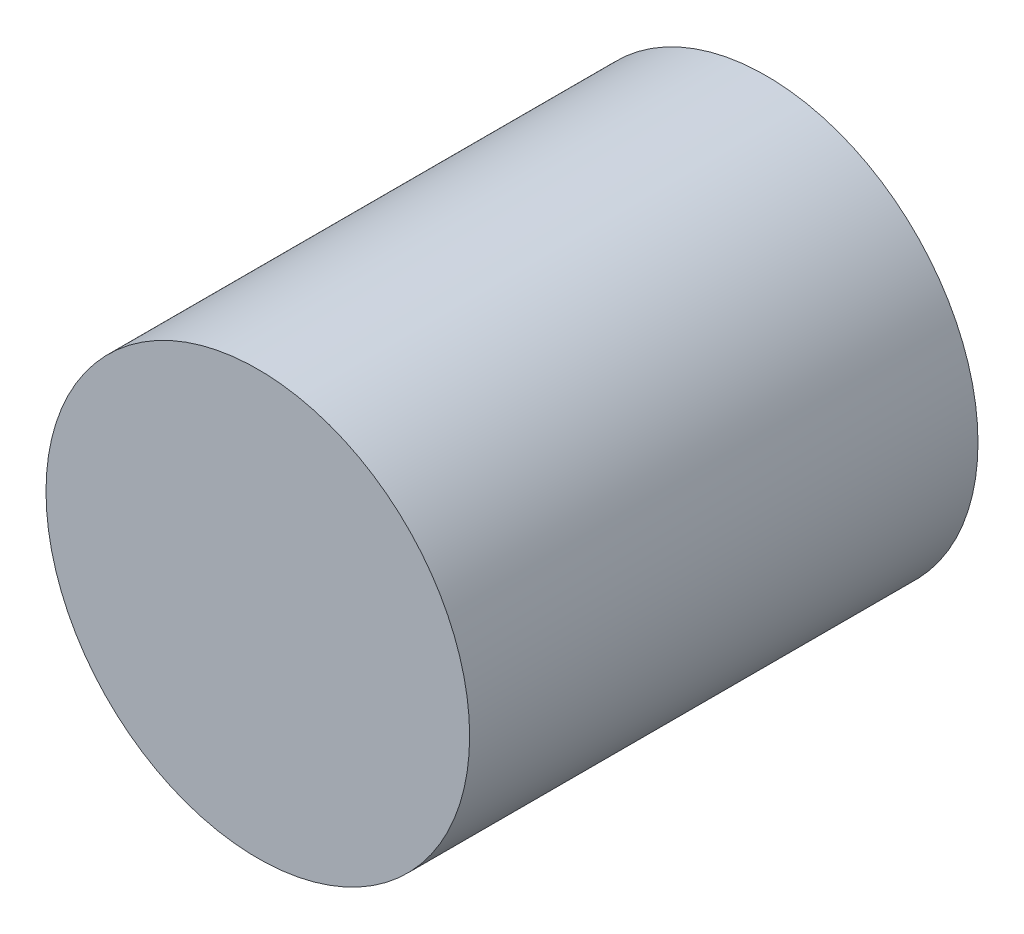
from build123d import *

# Parameters (mm, degrees)
SKETCH1_R           = 31.75
BOSS_EXTRUDE1_DEPTH = 76.2


with BuildPart() as part:
    # Sketch1 → Boss-Extrude1 (new body)
    with BuildSketch(Plane.XY):
        with Locations(Location((0, 0, 0), (0, 0, 180))):
            Circle(SKETCH1_R)
    extrude(amount=BOSS_EXTRUDE1_DEPTH)


solid = part.part
